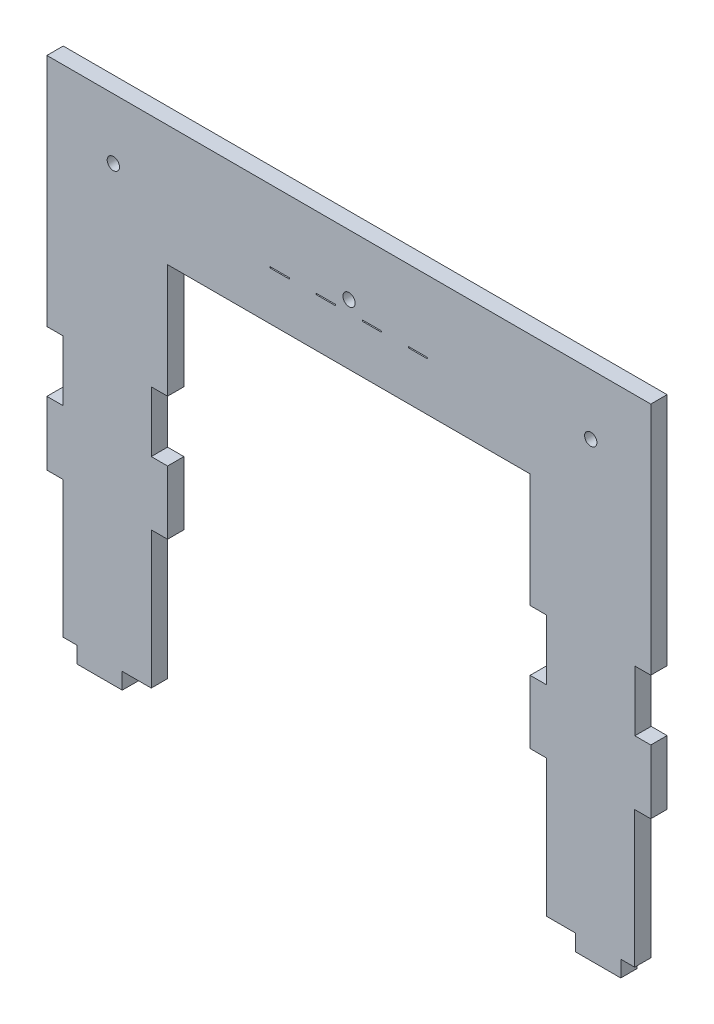
from build123d import *

# Parameters (mm, degrees)
SKETCH1_R  = 1.016
SKETCH1_W  = 3.175
SKETCH1_H  = 0.2
BASE_DEPTH = 2.7


with BuildPart() as part:
    # Sketch1 → Base (new body)
    with BuildSketch(Plane.XY):
        Polygon((-34.517386137, -9.480737498), (-34.517386137, 13.201100992), (-31.817386137, 13.201100992), (-31.817386137, 23.701100992), (-34.517386137, 23.701100992), (-34.517386137, 33.701100992), (-31.817386137, 33.701100992), (-31.817386137, 52.561262502), (28.182613863, 52.561262502), (28.182613863, 33.701100992), (30.882613863, 33.701100992), (30.882613863, 23.701100992), (28.182613863, 23.701100992), (28.182613863, 13.201100992), (30.882613863, 13.201100992), (30.882613863, -9.480737498), (35.682613863, -9.480737498), (35.682613863, -12.180737498), (43.182613863, -12.180737498), (43.182613863, -9.480737498), (45.482613863, -9.480737498), (45.482613863, 13.121905033), (48.150227726, 13.121905033), (48.150227726, 23.701100992), (45.515, 23.701100992), (45.515, 33.701100992), (48.150227726, 33.701100992), (48.150227726, 72.561262502), (-51.785, 72.561262502), (-51.785, 33.701100992), (-49.149772274, 33.701100992), (-49.149772274, 23.701100992), (-51.785, 23.701100992), (-51.785, 13.121905033), (-49.117386137, 13.121905033), (-49.117386137, -9.480737498), (-46.817386137, -9.480737498), (-46.817386137, -12.180737498), (-39.317386137, -12.180737498), (-39.317386137, -9.480737498), align=None)
        with Locations(Location((-40.7925, 62.561262502, 0), (0, 0, 180))):
            Circle(SKETCH1_R, mode=Mode.SUBTRACT)
        with Locations(Location((38.215, 62.561262502, 0), (0, 0, 180))):
            Circle(SKETCH1_R, mode=Mode.SUBTRACT)
        with Locations(Location((-1.785, 62.561262502, 0), (0, 0, 180))):
            Circle(SKETCH1_R, mode=Mode.SUBTRACT)
        with Locations((-13.247386137, 60.661262502)):
            Rectangle(SKETCH1_W, SKETCH1_H, mode=Mode.SUBTRACT)
        with Locations((-5.627386137, 60.661262502)):
            Rectangle(SKETCH1_W, SKETCH1_H, mode=Mode.SUBTRACT)
        with Locations((1.992613863, 60.661262502)):
            Rectangle(SKETCH1_W, SKETCH1_H, mode=Mode.SUBTRACT)
        with Locations((9.612613863, 60.661262502)):
            Rectangle(SKETCH1_W, SKETCH1_H, mode=Mode.SUBTRACT)
    extrude(amount=BASE_DEPTH)


solid = part.part
